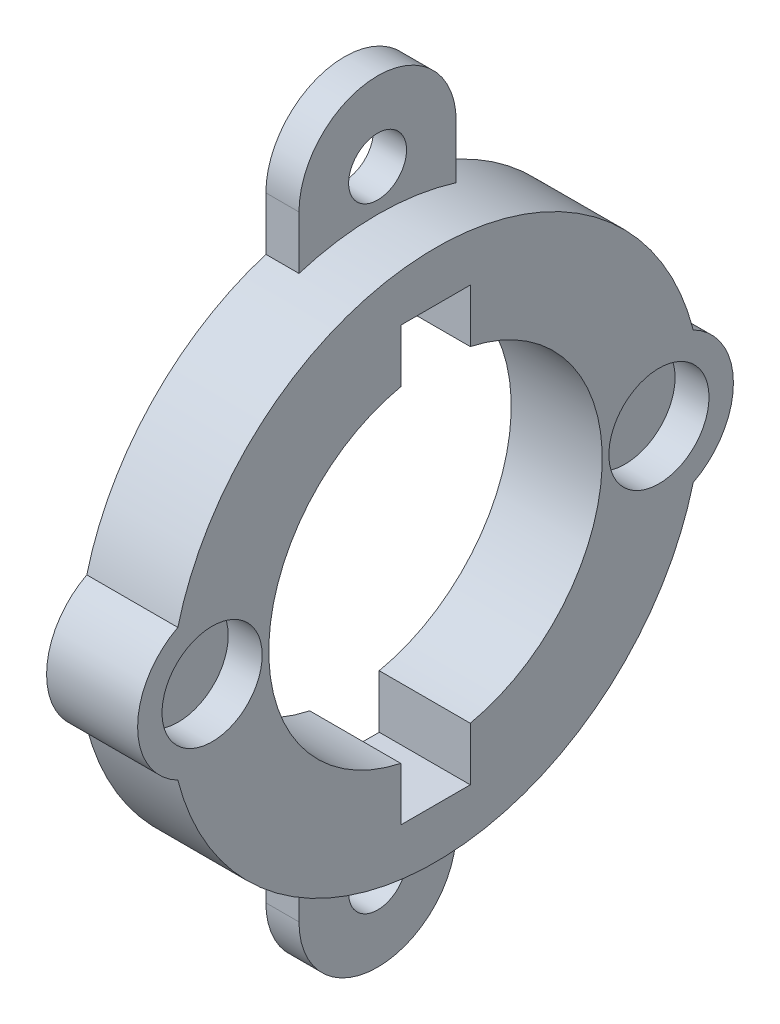
from build123d import *

# Parameters (mm, degrees)
SKETCH1_R           = 1.75
SKETCH1_R_2         = 10.075
BOSS_EXTRUDE1_DEPTH = 5
CUT_EXTRUDE1_START  = -5
SKETCH2_W           = 4.2
SKETCH2_H           = 26.15
CUT_EXTRUDE1_DEPTH  = 5
SKETCH3_R           = 16.075
BOSS_EXTRUDE2_DEPTH = 0.5
BOSS_EXTRUDE3_DEPTH = 5.5
SKETCH5_R           = 3.025
CUT_EXTRUDE2_DEPTH  = 2.05
CUT_EXTRUDE3_START  = -3
CUT_EXTRUDE3_DEPTH  = 3


with BuildPart() as part:
    # Sketch1 → Boss-Extrude1 (new body)
    with BuildSketch(Plane(origin=(0, 0, 0), x_dir=(0, 0, -1), z_dir=(1, 0, 0))):
        with BuildLine():
            Line((4.75, 15.357184801), (4.75, 18.575))
            ThreePointArc((4.75, 18.575), (0, 23.325), (-4.75, 18.575))
            Line((-4.75, 18.575), (-4.75, 15.357184801))
            ThreePointArc((-4.75, 15.357184801), (-16.075, 0), (-4.75, -15.357184801))
            Line((-4.75, -15.357184801), (-4.75, -18.575))
            ThreePointArc((-4.75, -18.575), (0, -23.325), (4.75, -18.575))
            Line((4.75, -18.575), (4.75, -15.357184801))
            ThreePointArc((4.75, -15.357184801), (16.075, 0), (4.75, 15.357184801))
        make_face()
        with Locations((0, 18.575)):
            Circle(SKETCH1_R, mode=Mode.SUBTRACT)
        Circle(SKETCH1_R_2, mode=Mode.SUBTRACT)
        with Locations(Location((0, -18.575, 0), (0, 0, 180))):
            Circle(SKETCH1_R, mode=Mode.SUBTRACT)
    extrude(amount=BOSS_EXTRUDE1_DEPTH)

    # Sketch2 → Cut-Extrude1 (cut)
    with BuildSketch(Plane.ZY.offset(CUT_EXTRUDE1_START)):
        Rectangle(SKETCH2_W, SKETCH2_H)
    extrude(amount=CUT_EXTRUDE1_DEPTH, mode=Mode.SUBTRACT)

    # Sketch3 → Boss-Extrude2 (add)
    with BuildSketch(Plane(origin=(5, 0, 0), x_dir=(0, 0, -1), z_dir=(1, 0, 0))):
        with Locations(Location((0, 0, 0), (0, 0, 107.186915706))):
            Circle(SKETCH3_R)
        with BuildLine():
            Line((-2.1, 13.075), (-2.1, 9.85371123))
            ThreePointArc((-2.1, 9.85371123), (-10.075, 0), (-2.1, -9.85371123))
            Line((-2.1, -9.85371123), (-2.1, -13.075))
            Line((-2.1, -13.075), (2.1, -13.075))
            Line((2.1, -13.075), (2.1, -9.85371123))
            ThreePointArc((2.1, -9.85371123), (10.075, 0), (2.1, 9.85371123))
            Line((2.1, 9.85371123), (2.1, 13.075))
            Line((2.1, 13.075), (-2.1, 13.075))
        make_face(mode=Mode.SUBTRACT)
    extrude(amount=BOSS_EXTRUDE2_DEPTH)

    # Sketch4 → Boss-Extrude3 (add)
    with BuildSketch(Plane.ZY):
        with BuildLine():
            Line((-13.5, -4.5), (-9.014190202, -4.5))
            ThreePointArc((-9.014190202, -4.5), (-10.075, 0), (-9.014190202, 4.5))
            Line((-9.014190202, 4.5), (-13.5, 4.5))
            ThreePointArc((-13.5, 4.5), (-18, 0), (-13.5, -4.5))
        make_face()
        with BuildLine():
            Line((13.5, 4.5), (9.014190202, 4.5))
            ThreePointArc((9.014190202, 4.5), (10.075, 0), (9.014190202, -4.5))
            Line((9.014190202, -4.5), (13.5, -4.5))
            ThreePointArc((13.5, -4.5), (18, 0), (13.5, 4.5))
        make_face()
    extrude(amount=-BOSS_EXTRUDE3_DEPTH)

    # Sketch5 → Cut-Extrude2 (cut)
    with BuildSketch(Plane(origin=(5.5, 0, 0), x_dir=(0, 0, -1), z_dir=(1, 0, 0))):
        with Locations((-13.5, 0)):
            Circle(SKETCH5_R)
        with Locations((13.5, 0)):
            Circle(SKETCH5_R)
    extrude(amount=-CUT_EXTRUDE2_DEPTH, mode=Mode.SUBTRACT)

    # Sketch6 → Cut-Extrude3 (cut)
    with BuildSketch(Plane(origin=(5, 0, 0), x_dir=(0, 0, -1), z_dir=(1, 0, 0)).offset(CUT_EXTRUDE3_START)):
        with BuildLine():
            Line((4.75, 15.357184801), (4.75, 18.575))
            ThreePointArc((4.75, 18.575), (0, 23.325), (-4.75, 18.575))
            Line((-4.75, 18.575), (-4.75, 15.357184801))
            ThreePointArc((-4.75, 15.357184801), (0, 16.075), (4.75, 15.357184801))
        make_face()
        with BuildLine():
            Line((-4.75, -15.357184801), (-4.75, -18.575))
            ThreePointArc((-4.75, -18.575), (0, -23.325), (4.75, -18.575))
            Line((4.75, -18.575), (4.75, -15.357184801))
            ThreePointArc((4.75, -15.357184801), (0, -16.075), (-4.75, -15.357184801))
        make_face()
    extrude(amount=CUT_EXTRUDE3_DEPTH, mode=Mode.SUBTRACT)


solid = part.part
